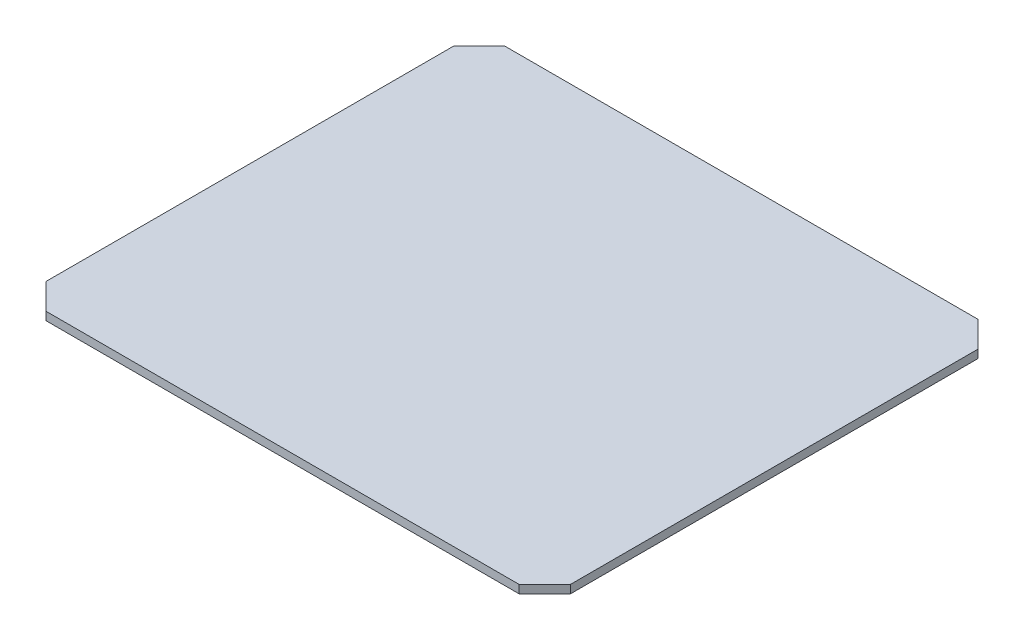
from build123d import *

# Parameters (mm, degrees)
SKETCH1_W           = 203.2
SKETCH1_H           = 177.8
BOSS_EXTRUDE1_DEPTH = 3.175
CHAMFER1_SIZE       = 10


with BuildPart() as part:
    # Sketch1 → Boss-Extrude1 (new body)
    with BuildSketch(Plane(origin=(0, 0, 0), x_dir=(1, 0, 0), z_dir=(0, 1, 0))):
        Rectangle(SKETCH1_W, SKETCH1_H)
    extrude(amount=BOSS_EXTRUDE1_DEPTH)

    # Chamfer1
    chamfer1_edges = [part.edges().sort_by_distance(p)[0] for p in [
        (-101.6, 1.5875, -88.9),
        (101.6, 1.5875, -88.9),
        (101.6, 1.5875, 88.9),
        (-101.6, 1.5875, 88.9),
    ]]
    chamfer(chamfer1_edges, length=CHAMFER1_SIZE)


solid = part.part
